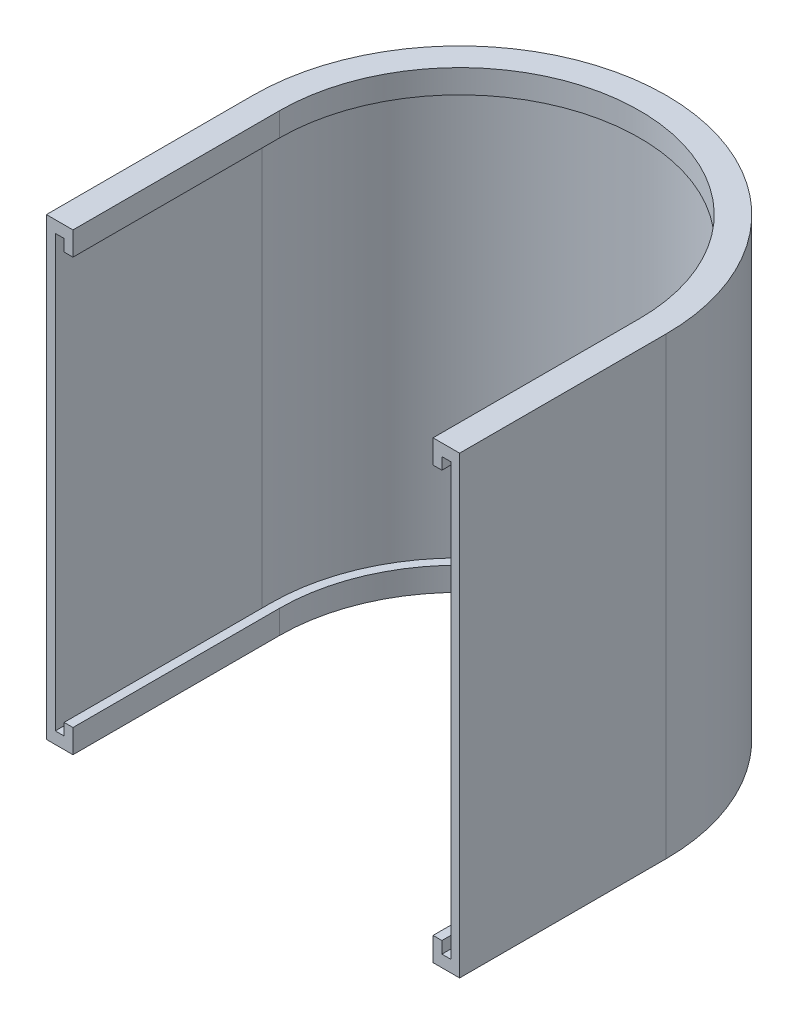
from build123d import *
from build123d.topology import SkipClean

# Parameters (mm, degrees)
EXTRUDE_1_DEPTH     = 2
EXTRUDE_2_DEPTH     = 73
EXTRUDE_3_DEPTH     = 2
EXTRUDE_4_DEPTH     = 2
EXTRUDE_START       = 2
EXTRUDE_5_DEPTH     = 2
CUT_EXTRUDE_START   = -80
CUT_EXTRUDE_1_DEPTH = 80


with BuildPart() as part:
    # 草图1 → 凸台-拉伸1 (new body)
    with BuildSketch(Plane(origin=(0, 0, 0), x_dir=(1, 0, 0), z_dir=(0, 1, 0))):
        with BuildLine():
            Line((-35, 0), (-35, -35))
            Line((-35, -35), (35, -35))
            Line((35, -35), (35, 0))
            ThreePointArc((35, 0), (0, 35), (-35, 0))
        make_face()
    extrude(amount=EXTRUDE_1_DEPTH)

    # 草图5 → 凸台-拉伸2 (add)
    with BuildSketch(Plane(origin=(0, 2, 0), x_dir=(1, 0, 0), z_dir=(0, 1, 0))):
        with BuildLine():
            Line((33.5, -35), (35, -35))
            Line((35, -35), (35, 0))
            ThreePointArc((35, 0), (0, 35), (-35, 0))
            Line((-35, 0), (-35, -35))
            Line((-35, -35), (-33.5, -35))
            Line((-33.5, -35), (-33.5, 0))
            ThreePointArc((-33.5, 0), (0, 33.5), (33.5, 0))
            Line((33.5, 0), (33.5, -35))
        make_face()
    extrude(amount=EXTRUDE_2_DEPTH)

    # 草图6 → 凸台-拉伸3 (add)
    with BuildSketch(Plane(origin=(0, 2, 0), x_dir=(1, 0, 0), z_dir=(0, 1, 0))):
        with BuildLine():
            Line((-32, 0), (-32, -35))
            Line((-32, -35), (-30.5, -35))
            Line((-30.5, -35), (-30.5, 0))
            ThreePointArc((-30.5, 0), (0, 30.5), (30.5, 0))
            Line((30.5, 0), (30.5, -35))
            Line((30.5, -35), (32, -35))
            Line((32, -35), (32, 0))
            ThreePointArc((32, 0), (0, 32), (-32, 0))
        make_face()
    extrude(amount=EXTRUDE_3_DEPTH)

    # 草图8 → 凸台-拉伸4 (add)
    with BuildSketch(Plane(origin=(0, 75, 0), x_dir=(1, 0, 0), z_dir=(0, 1, 0))):
        with BuildLine():
            Line((-35, 0), (-35, -35))
            Line((-35, -35), (35, -35))
            Line((35, -35), (35, 0))
            ThreePointArc((35, 0), (0, 35), (-35, 0))
        make_face()
    extrude(amount=EXTRUDE_4_DEPTH)

    # 草图10 → 凸台-拉伸5 (add)
    with BuildSketch(Plane.XZ.offset(-75).offset(EXTRUDE_START)):
        with BuildLine():
            Line((-32, 0), (-32, 35))
            Line((-32, 35), (-30.5, 35))
            Line((-30.5, 35), (-30.5, 0))
            ThreePointArc((-30.5, 0), (0, -30.5), (30.5, 0))
            Line((30.5, 0), (30.5, 35))
            Line((30.5, 35), (32, 35))
            Line((32, 35), (32, 0))
            ThreePointArc((32, 0), (0, -32), (-32, 0))
        make_face()
    extrude(amount=-EXTRUDE_5_DEPTH)

    # 草图12 → 切除-拉伸1 (cut)
    with SkipClean():  # the faces are left unmerged after this step: merging them gives an invalid solid
        with BuildSketch(Plane(origin=(0, 77, 0), x_dir=(1, 0, 0), z_dir=(0, 1, 0)).offset(CUT_EXTRUDE_START)):
            with BuildLine():
                Line((-30.5, -30.5), (-30.5, -35))
                Line((-30.5, -35), (30.5, -35))
                Line((30.5, -35), (30.5, -30.5))
                Line((30.5, -30.5), (30.5, 0))
                ThreePointArc((30.5, 0), (0, 30.5), (-30.5, 0))
                Line((-30.5, 0), (-30.5, -30.5))
            make_face()
        extrude(amount=CUT_EXTRUDE_1_DEPTH, mode=Mode.SUBTRACT)


solid = part.part
